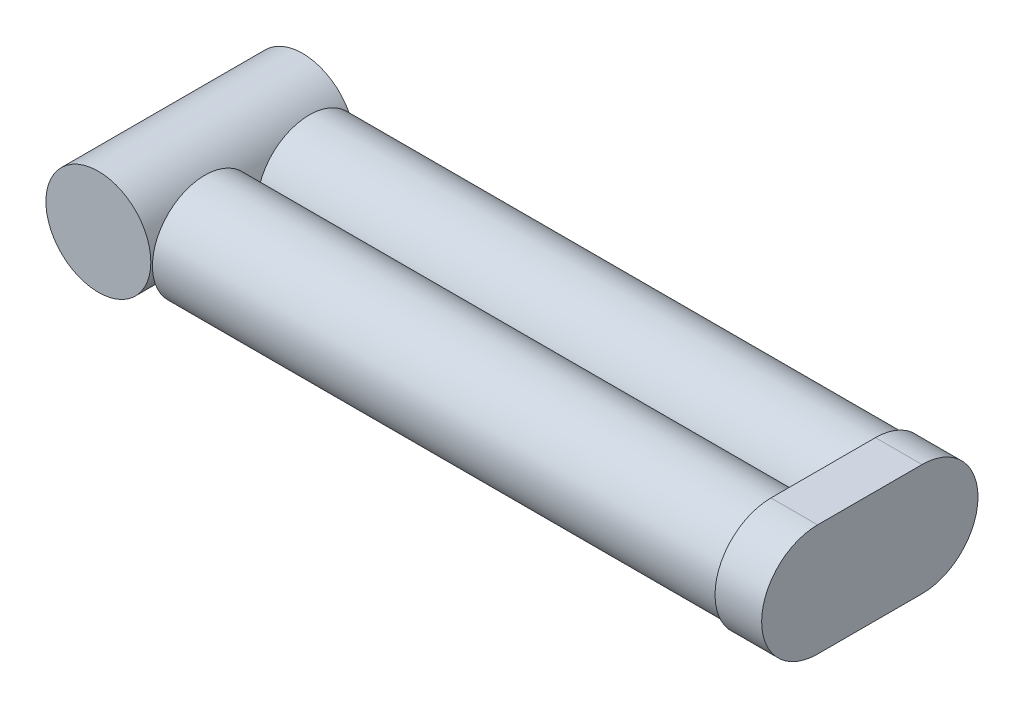
from build123d import *

# Parameters (mm, degrees)
SKETCH1_R           = 11.25
BOSS_EXTRUDE1_DEPTH = 131.4
BOSS_EXTRUDE5_DEPTH = 1
BOSS_EXTRUDE6_DEPTH = 9
SKETCH4_R           = 11.25
BOSS_EXTRUDE7_DEPTH = 21.9


with BuildPart() as part:
    # Sketch1 → Boss-Extrude1 (new body)
    with BuildSketch(Plane(origin=(0, 0, 0), x_dir=(0, 0, -1), z_dir=(1, 0, 0))):
        with Locations((-11.2, 0)):
            Circle(SKETCH1_R)
        with Locations((11.2, 0)):
            Circle(SKETCH1_R)
        with Locations((11.2, 0)):
            Circle(SKETCH1_R)
        with Locations((-11.2, 0)):
            Circle(SKETCH1_R)
    extrude(amount=BOSS_EXTRUDE1_DEPTH)

    # Sketch2 → Boss-Extrude5 (add)
    with BuildSketch(Plane(origin=(131.4, 0, 0), x_dir=(0, 0, -1), z_dir=(1, 0, 0))):
        with BuildLine():
            Line((11.2, -12), (-11.2, -12))
            ThreePointArc((-11.2, -12), (-23.2, 0), (-11.2, 12))
            Line((-11.2, 12), (11.2, 12))
            ThreePointArc((11.2, 12), (23.2, 0), (11.2, -12))
        make_face()
    extrude(amount=-BOSS_EXTRUDE5_DEPTH)

    # Sketch3 → Boss-Extrude6 (add)
    with BuildSketch(Plane.ZY.offset(-130.4)):
        with BuildLine():
            Line((-11.2, -12), (11.2, -12))
            ThreePointArc((11.2, -12), (23.2, 0), (11.2, 12))
            Line((11.2, 12), (-11.2, 12))
            ThreePointArc((-11.2, 12), (-23.2, 0), (-11.2, -12))
        make_face()
        with BuildLine():
            Line((-11.2, -11), (11.2, -11))
            ThreePointArc((11.2, -11), (22.2, 0), (11.2, 11))
            Line((11.2, 11), (-11.2, 11))
            ThreePointArc((-11.2, 11), (-22.2, 0), (-11.2, -11))
        make_face(mode=Mode.SUBTRACT)
    extrude(amount=BOSS_EXTRUDE6_DEPTH)


with BuildPart() as body_2:
    # Sketch4 → Boss-Extrude7 (new, symmetric)
    with BuildSketch(Plane.XY):
        with Locations((-12.15, 0)):
            Circle(SKETCH4_R)
    extrude(amount=BOSS_EXTRUDE7_DEPTH, both=True)


solid = Compound([part.part, body_2.part])
